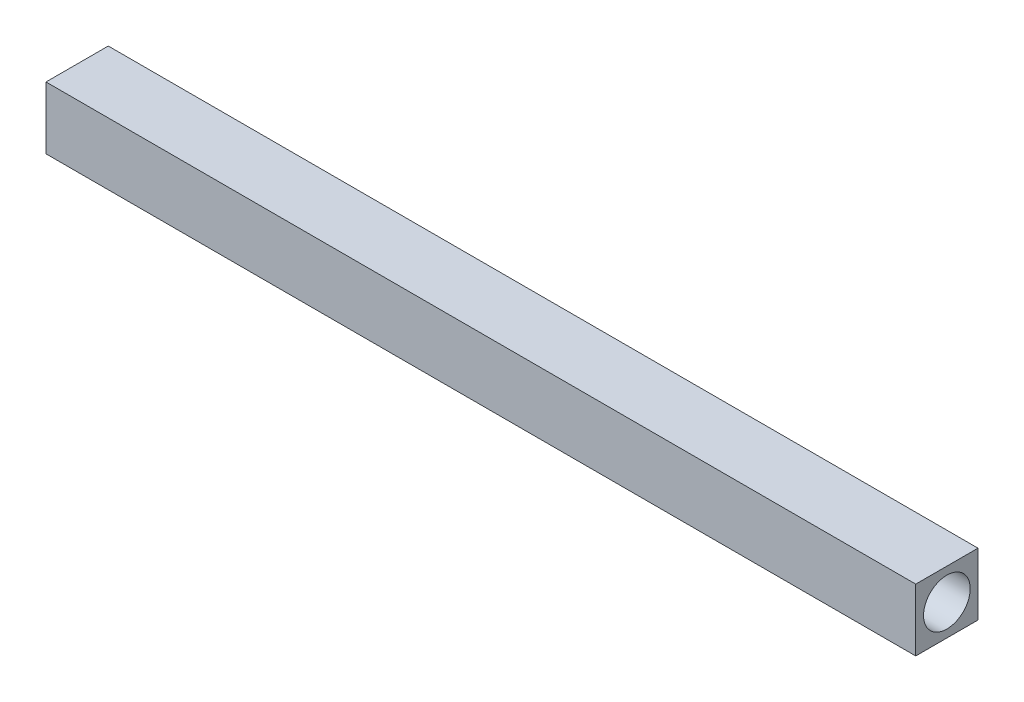
from build123d import *

# Parameters (mm, degrees)
SKETCH1_W           = 20
SKETCH1_H           = 20
BOSS_EXTRUDE1_DEPTH = 279.4
SKETCH3_R           = 7.5
BOSS_EXTRUDE2_DEPTH = 1.5
SKETCH2_R           = 7.5
CUT_EXTRUDE1_DEPTH  = 266.7


with BuildPart() as part:
    # Sketch1 → Boss-Extrude1 (new body)
    with BuildSketch(Plane(origin=(0, 0, 0), x_dir=(0, 0, -1), z_dir=(1, 0, 0))):
        with Locations((-10, 10)):
            Rectangle(SKETCH1_W, SKETCH1_H)
    extrude(amount=BOSS_EXTRUDE1_DEPTH)

    # Sketch3 → Boss-Extrude2 (add)
    with BuildSketch(Plane(origin=(0, 0, 0), x_dir=(-1, 0, 0), z_dir=(0, 0, -1))):
        with Locations((-10, 10)):
            Circle(SKETCH3_R)
    extrude(amount=BOSS_EXTRUDE2_DEPTH)

    # Sketch2 → Cut-Extrude1 (cut)
    with BuildSketch(Plane(origin=(279.4, 0, 0), x_dir=(0, 0, -1), z_dir=(1, 0, 0))):
        with Locations((-10, 10)):
            Circle(SKETCH2_R)
    extrude(amount=-CUT_EXTRUDE1_DEPTH, mode=Mode.SUBTRACT)


solid = part.part
